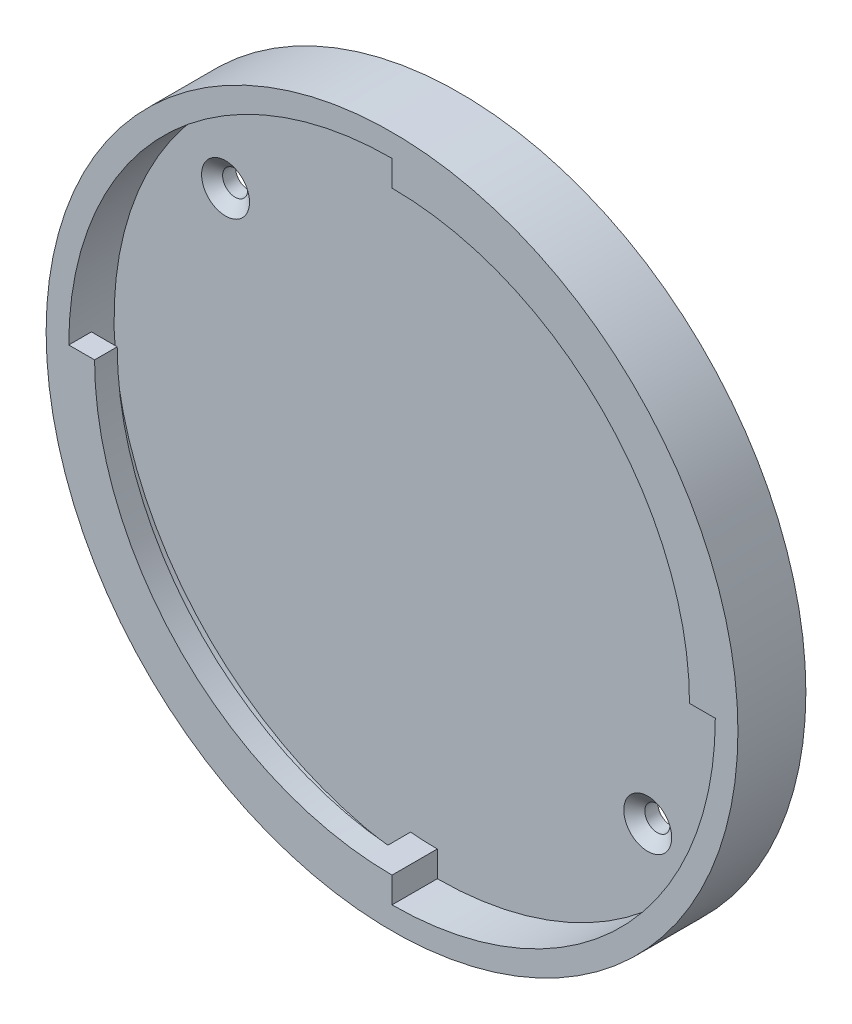
from build123d import *

# Parameters (mm, degrees)
CUT_EXTRUDE1_START                                  = -12.700000000000001
CUT_EXTRUDE1_DEPTH                                  = 12.700000000000001
BOSS_EXTRUDE1_DEPTH                                 = 12.700000000000001
CSK_FOR_5_16_FLAT_HEAD_MACHINE_SCREW_10_D           = 8.4328
CSK_FOR_5_16_FLAT_HEAD_MACHINE_SCREW_10_CSINK_D     = 16.129
CSK_FOR_5_16_FLAT_HEAD_MACHINE_SCREW_10_CSINK_ANGLE = 100


with BuildPart() as part:
    # Sketch1 → Revolve1 (revolve)
    with BuildSketch(Plane(origin=(0, 0, 0), x_dir=(1, 0, 0), z_dir=(0, 1, 0)), mode=Mode.PRIVATE) as revolve1_sk:
        Polygon((0, 0), (-116.39944919199999, -1.425e-14), (-116.39944919199999, -6.350000000000014), (-116.39944919199999, -22.86), (-109.82551422519657, -22.86), (-100.09689936468882, -22.86), (-100.09689936468882, -15.239999999999998), (-108.77944919199999, -15.239999999999998), (-108.77944919199999, -7.619999999999999), (0, -7.619999999999999), align=None)
    revolve(revolve1_sk.sketch.rotate(Axis((0, 0, 7.619999999999999), (0, 0, -1)), 180), axis=Axis((0, 0, 7.619999999999999), (0, 0, -1)))

    # Sketch2 → Cut-Extrude1 (cut)
    with BuildSketch(Plane.XY.offset(22.86).offset(CUT_EXTRUDE1_START)):
        with BuildLine():
            Line((-108.77944919199999, -1.239e-14), (-14.769960459073417, 0))
            Line((-14.769960459073417, 0), (-4.49e-15, 14.76996045907346))
            Line((-4.49e-15, 14.76996045907346), (9.3e-16, 108.77944919199999))
            ThreePointArc((9.3e-16, 108.77944919199999), (-76.91868617740069, 76.9186861774007), (-108.77944919199999, -1.239e-14))
        make_face()
        with BuildLine():
            Line((2.664e-14, -108.77944919199999), (0, -24.8599350617269))
            Line((0, -24.8599350617269), (26.65786083148447, 0))
            Line((26.65786083148447, 0), (108.77944919199999, -9.3e-16))
            ThreePointArc((108.77944919199999, -9.3e-16), (76.9186861774007, -76.91868617740069), (2.664e-14, -108.77944919199999))
        make_face()
    extrude(amount=CUT_EXTRUDE1_DEPTH, mode=Mode.SUBTRACT)

    # Sketch4 → Boss-Extrude1 (add)
    with BuildSketch(Plane.XY.offset(7.619999999999999)):
        with BuildLine():
            Line((0, 108.77944919199999), (4.3e-16, 100.09689936468882))
            ThreePointArc((4.3e-16, 100.09689936468882), (4.507744656252515, 99.99534739445967), (9.006342768425501, 99.69089754015798))
            Line((9.006342768425501, 99.69089754015798), (9.006342768425501, 108.40597011443852))
            ThreePointArc((9.006342768425501, 108.40597011443852), (4.507041620723805, 108.68603931666647), (0, 108.77944919199999))
        make_face()
        with BuildLine():
            Line((2.389e-14, -100.09689936468882), (2.664e-14, -108.77944919199999))
            ThreePointArc((2.664e-14, -108.77944919199999), (-4.5070416207237916, -108.68603931666647), (-9.006342768425498, -108.40597011443852))
            Line((-9.006342768425498, -108.40597011443852), (-9.006342768425498, -99.69089754015796))
            ThreePointArc((-9.006342768425498, -99.69089754015796), (-4.507744656252502, -99.99534739445966), (2.389e-14, -100.09689936468882))
        make_face()
    extrude(amount=BOSS_EXTRUDE1_DEPTH)

    # CSK for 5/16 Flat Head Machine Screw (100)1 (through all)
    with Locations(Plane(origin=(-71.265307908, 56.784373632, 7.62), x_dir=(1, 0, 0), z_dir=(0, 0, 1))):
        with Locations((0, 0), (142.072512407, -114.138963606)):
            CounterSinkHole(CSK_FOR_5_16_FLAT_HEAD_MACHINE_SCREW_10_D / 2, CSK_FOR_5_16_FLAT_HEAD_MACHINE_SCREW_10_CSINK_D / 2, counter_sink_angle=CSK_FOR_5_16_FLAT_HEAD_MACHINE_SCREW_10_CSINK_ANGLE)


solid = part.part
